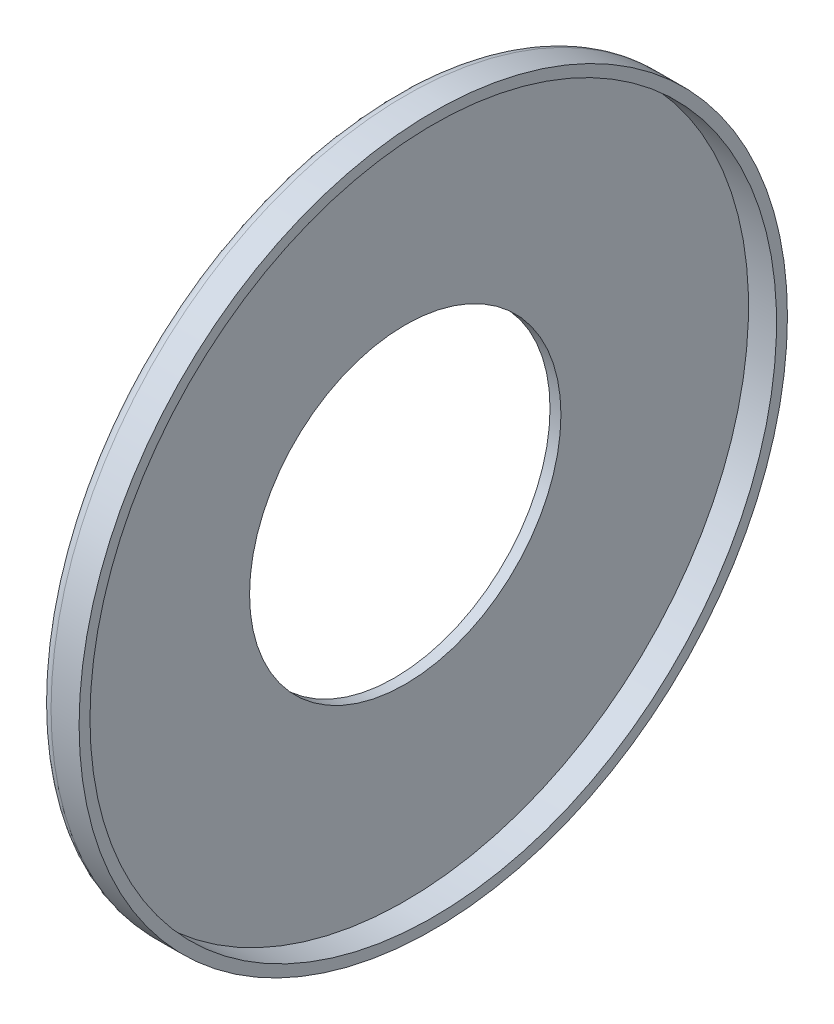
from build123d import *


with BuildPart() as part:
    # Croquis1 → Revolución1 (revolve)
    with BuildSketch(Plane.XY, mode=Mode.PRIVATE) as revoluci_n1_sk:
        with BuildLine():
            Line((0.7, 10), (0.7, 22.05))
            Line((0.7, 22.05), (2.5, 22.05))
            Line((2.5, 22.05), (2.5, 22.75))
            Line((2.5, 22.75), (0.7, 22.75))
            ThreePointArc((0.7, 22.75), (0.205025253, 22.544974747), (0, 22.05))
            Line((0, 22.05), (0, 10))
            Line((0, 10), (0.7, 10))
        make_face()
    revolve(revoluci_n1_sk.sketch.rotate(Axis((0, 0, 0), (1, 0, 0)), 90), axis=Axis((0, 0, 0), (1, 0, 0)))


solid = part.part
